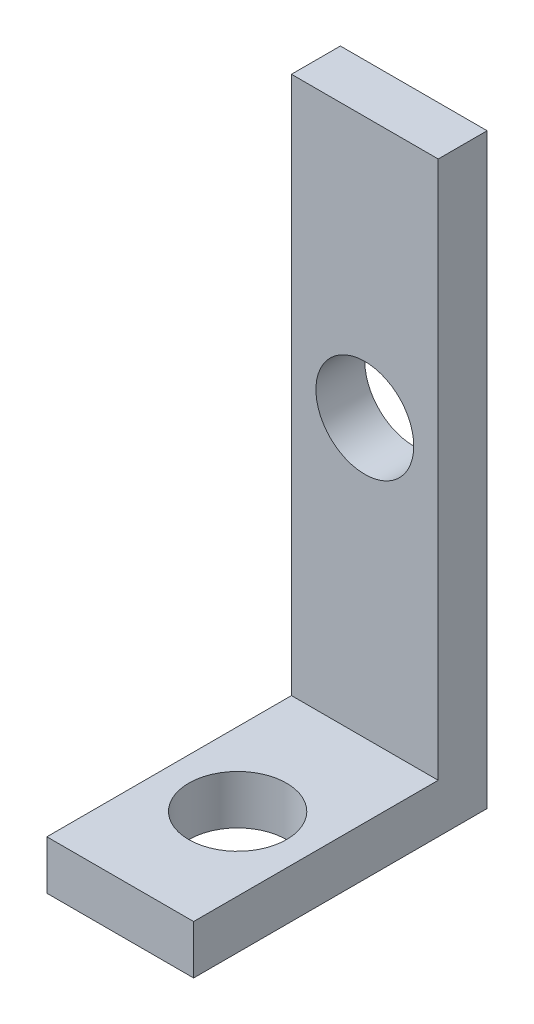
from build123d import *

# Parameters (mm, degrees)
SKETCH1_W           = 3.81
SKETCH1_H           = 15.24
BOSS_EXTRUDE1_DEPTH = 1.27
SKETCH2_W           = 3.81
SKETCH2_H           = 1.27
BOSS_EXTRUDE2_DEPTH = 6.35
SKETCH6_R           = 1.27
CUT_EXTRUDE1_DEPTH  = 6.35
SKETCH4_R           = 1.27
CUT_EXTRUDE2_DEPTH  = 6.35


with BuildPart() as part:
    # Sketch1 → Boss-Extrude1 (new body)
    with BuildSketch(Plane.XY):
        with Locations((1.905, 7.62)):
            Rectangle(SKETCH1_W, SKETCH1_H)
    extrude(amount=BOSS_EXTRUDE1_DEPTH)

    # Sketch2 → Boss-Extrude2 (add)
    with BuildSketch(Plane.XY.offset(1.27)):
        with Locations((1.905, 0.635)):
            Rectangle(SKETCH2_W, SKETCH2_H)
    extrude(amount=BOSS_EXTRUDE2_DEPTH)

    # Sketch6 → Cut-Extrude1 (cut)
    with BuildSketch(Plane(origin=(0, 1.27, 0), x_dir=(1, 0, 0), z_dir=(0, 1, 0))):
        with Locations(Location((1.905, -4.572, 0), (0, 0, 270))):
            Circle(SKETCH6_R)
    extrude(amount=-CUT_EXTRUDE1_DEPTH, mode=Mode.SUBTRACT)

    # Sketch4 → Cut-Extrude2 (cut)
    with BuildSketch(Plane.XY.offset(1.27)):
        with Locations((1.905, 8.466666667)):
            Circle(SKETCH4_R)
    extrude(amount=-CUT_EXTRUDE2_DEPTH, mode=Mode.SUBTRACT)


solid = part.part
